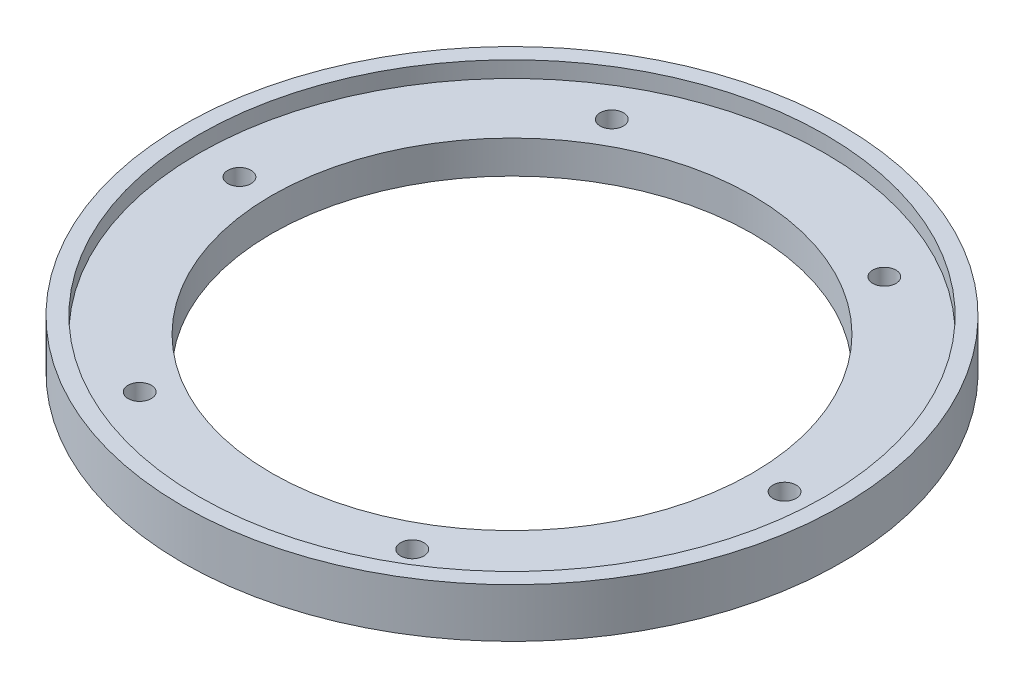
from build123d import *

# Parameters (mm, degrees)
SKETCH_3_R          = 2.15
CUT_EXTRUDE_2_DEPTH = 10


with BuildPart() as part:
    # 草图1 → 旋转1 (revolve)
    with BuildSketch(Plane.XY, mode=Mode.PRIVATE) as revolve_1_sk:
        Polygon((44.5, 0), (58, 0), (61, 0), (61, 9.1), (58, 9.1), (58, 6.1), (44.5, 6.1), align=None)
    revolve(revolve_1_sk.sketch.rotate(Axis((0, 0, 0), (0, 1, 0)), 90), axis=Axis((0, 0, 0), (0, 1, 0)))

    # 草图3 → 切除-拉伸2 (cut)
    with BuildSketch(Plane(origin=(0, 6.1, 0), x_dir=(1, 0, 0), z_dir=(0, 1, 0))):
        with Locations(Location((-50.45, 0, 0), (0, 0, 270))):
            Circle(SKETCH_3_R)
        with Locations(Location((-25.225, 43.690981621, 0), (0, 0, 270))):
            Circle(SKETCH_3_R)
        with Locations(Location((25.225, 43.690981621, 0), (0, 0, 270))):
            Circle(SKETCH_3_R)
        with Locations(Location((50.45, 0, 0), (0, 0, 270))):
            Circle(SKETCH_3_R)
        with Locations(Location((25.225, -43.690981621, 0), (0, 0, 270))):
            Circle(SKETCH_3_R)
        with Locations(Location((-25.225, -43.690981621, 0), (0, 0, 270))):
            Circle(SKETCH_3_R)
    extrude(amount=-CUT_EXTRUDE_2_DEPTH, mode=Mode.SUBTRACT)


solid = part.part
